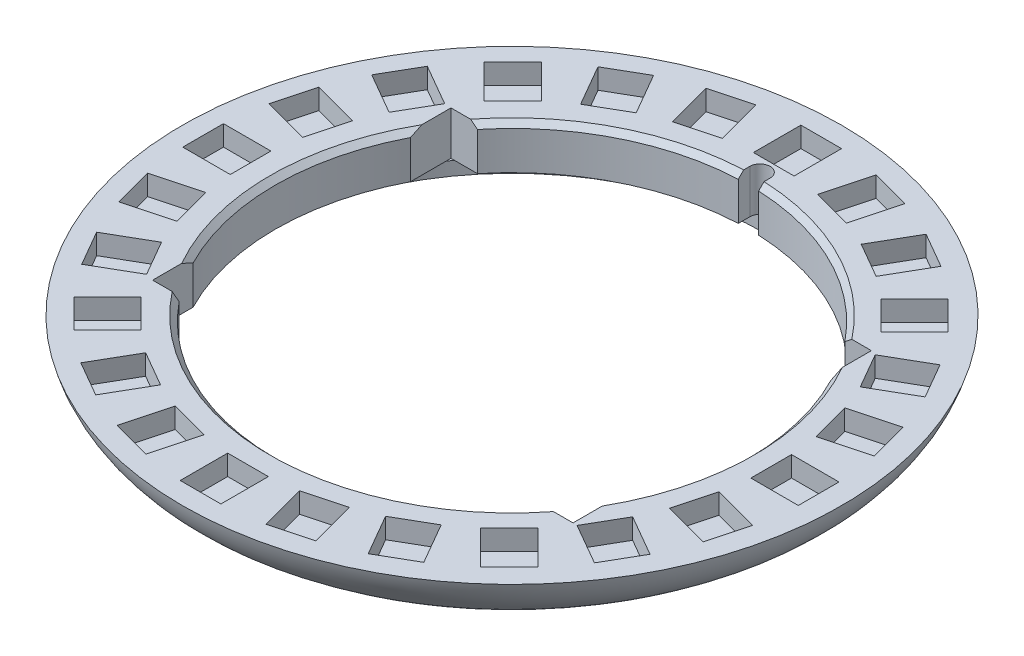
from build123d import *

# Parameters (mm, degrees)
ESQUISSE2_W             = 62
ESQUISSE2_H             = 44
ENL_V_MAT_EXTRU_1_DEPTH = 6.440596868
ESQUISSE3_W             = 6
ESQUISSE3_H             = 7
ESQUISSE3_W_2           = 7
ESQUISSE3_H_2           = 6
ENL_V_MAT_EXTRU_2_DEPTH = 3
ENL_V_MAT_EXTRU_3_DEPTH = 6.440596868
CHANFREIN1_SIZE         = 0.8


with BuildPart() as part:
    # Esquisse1 → Révolution1 (revolve)
    with BuildSketch(Plane.XY, mode=Mode.PRIVATE) as r_volution1_sk:
        with BuildLine():
            Line((37.6, 0), (37.6, 2))
            Line((37.6, 2), (34.9, 2))
            Line((34.9, 2), (34.9, 8.440596868))
            Line((34.9, 8.440596868), (48.6, 8.440596868))
            ThreePointArc((48.6, 8.440596868), (44.532598277, 2.35330001), (37.6, 0))
        make_face()
    revolve(r_volution1_sk.sketch.rotate(Axis((0, 0, 0), (0, 1, 0)), 90), axis=Axis((0, 0, 0), (0, 1, 0)))

    # Esquisse2 → Enlèv. mat.-Extru.1 (cut)
    with BuildSketch(Plane(origin=(0, 8.440596868, 0), x_dir=(1, 0, 0), z_dir=(0, 1, 0))):
        Rectangle(ESQUISSE2_W, ESQUISSE2_H)
    extrude(amount=-ENL_V_MAT_EXTRU_1_DEPTH, mode=Mode.SUBTRACT)

    # Esquisse3 → Enlèv. mat.-Extru.2 (cut)
    with BuildSketch(Plane(origin=(0, 8.440596868, 0), x_dir=(1, 0, 0), z_dir=(0, 1, 0))):
        with Locations((0, 42.1)):
            Rectangle(ESQUISSE3_W, ESQUISSE3_H)
        Polygon((8.891430026, 44.774378523), (14.686984983, 43.221464252), (12.875251668, 36.459983468), (7.07969671, 38.012897739), align=None)
        Polygon((20.163982836, 40.899160851), (25.360135259, 37.899160851), (21.860135259, 31.836983025), (16.663982836, 34.836983025), align=None)
        Polygon((30.049452587, 34.238436665), (34.292093274, 29.995795978), (29.342345806, 25.04604851), (25.099705119, 29.288689197), align=None)
        Polygon((37.874160851, 25.246123311), (40.874160851, 20.049970888), (34.811983025, 16.549970888), (31.811983025, 21.746123311), align=None)
        Polygon((43.104866691, 14.535032083), (44.657780961, 8.739477125), (37.896300177, 6.927743809), (36.343385907, 12.723298767), align=None)
        with Locations((41.885106147, -0.164893853)):
            Rectangle(ESQUISSE3_W_2, ESQUISSE3_H_2)
        Polygon((44.55948467, -9.056323878), (43.006570399, -14.851878836), (36.245089615, -13.04014552), (37.798003886, -7.244590563), align=None)
        Polygon((40.684266998, -20.328876689), (37.684266998, -25.525029112), (31.622089172, -22.025029112), (34.622089172, -16.828876689), align=None)
        Polygon((34.023542812, -30.21434644), (29.780902125, -34.456987127), (24.831154657, -29.507239659), (29.073795344, -25.264598972), align=None)
        Polygon((25.031229458, -38.039054704), (19.835077035, -41.039054704), (16.335077035, -34.976876877), (21.531229458, -31.976876877), align=None)
        Polygon((14.32013823, -43.269760543), (8.524583272, -44.822674814), (6.712849956, -38.06119403), (12.508404914, -36.508279759), align=None)
        with Locations((-0.379787706, -42.05)):
            Rectangle(ESQUISSE3_W, ESQUISSE3_H)
        Polygon((-9.271217731, -44.724378523), (-15.066772689, -43.171464252), (-13.255039373, -36.409983468), (-7.459484415, -37.962897739), align=None)
        Polygon((-20.543770542, -40.849160851), (-25.739922965, -37.849160851), (-22.239922965, -31.786983025), (-17.043770542, -34.786983025), align=None)
        Polygon((-30.429240293, -34.188436665), (-34.67188098, -29.945795978), (-29.722133512, -24.99604851), (-25.479492825, -29.238689197), align=None)
        Polygon((-38.253948557, -25.196123311), (-41.253948557, -19.999970888), (-35.19177073, -16.499970888), (-32.19177073, -21.696123311), align=None)
        Polygon((-43.484654396, -14.485032083), (-45.037568667, -8.689477125), (-38.276087883, -6.877743809), (-36.723173612, -12.673298767), align=None)
        with Locations((-42.264893853, 0.214893853)):
            Rectangle(ESQUISSE3_W_2, ESQUISSE3_H_2)
        Polygon((-44.939272376, 9.106323878), (-43.386358105, 14.901878836), (-36.624877321, 13.09014552), (-38.177791592, 7.294590563), align=None)
        Polygon((-41.064054704, 20.378876689), (-38.064054704, 25.575029112), (-32.001876877, 22.075029112), (-35.001876877, 16.878876689), align=None)
        Polygon((-34.403330518, 30.26434644), (-30.160689831, 34.506987127), (-25.210942362, 29.557239659), (-29.45358305, 25.314598972), align=None)
        Polygon((-25.411017164, 38.089054704), (-20.214864741, 41.089054704), (-16.714864741, 35.026876877), (-21.911017164, 32.026876877), align=None)
        Polygon((-14.699925936, 43.319760543), (-8.904370978, 44.872674814), (-7.092637662, 38.11119403), (-12.88819262, 36.558279759), align=None)
    extrude(amount=-ENL_V_MAT_EXTRU_2_DEPTH, mode=Mode.SUBTRACT)

    # Esquisse4 → Enlèv. mat.-Extru.3 (cut)
    with BuildSketch(Plane(origin=(0, 8.440596868, 0), x_dir=(1, 0, 0), z_dir=(0, 1, 0))):
        with BuildLine():
            Line((-1.5, 36.567750143), (-1.5, 34.867750143))
            Line((-1.5, 34.867750143), (1.5, 34.867750143))
            Line((1.5, 34.867750143), (1.5, 36.567750143))
            ThreePointArc((1.5, 36.567750143), (0, 38.067750143), (-1.5, 36.567750143))
        make_face()
    extrude(amount=-ENL_V_MAT_EXTRU_3_DEPTH, mode=Mode.SUBTRACT)

    # Chanfrein1
    chanfrein1_edges = [part.edges().sort_by_distance(p)[0] for p in [
        (34.9, 8.440596868, 0),
        (0, 8.440596868, 34.9),
        (-34.9, 8.440596868, 0),
        (-15.677347117, 8.440596868, -31.180615571),
        (15.677347117, 8.440596868, -31.180615571),
    ]]
    chamfer(chanfrein1_edges, length=CHANFREIN1_SIZE)


solid = part.part
